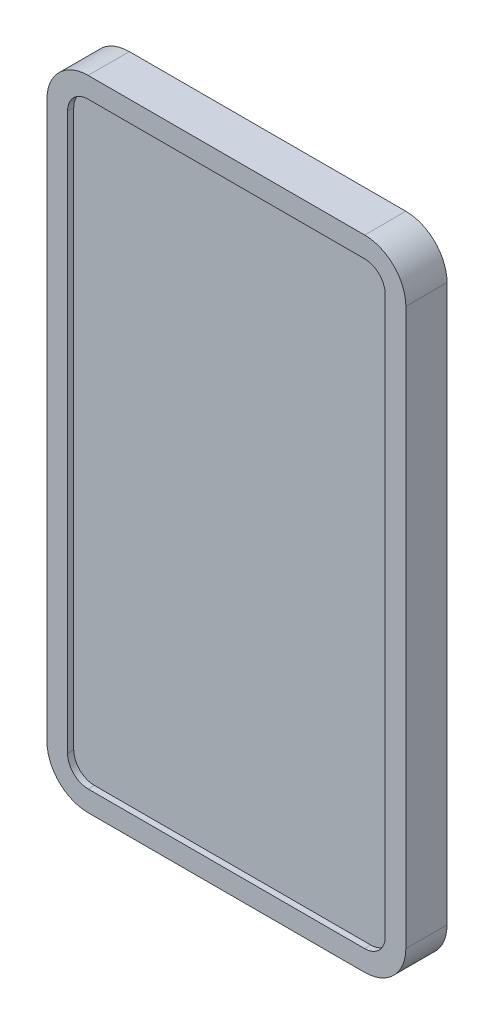
from build123d import *

# Parameters (mm, degrees)
BOSS_EXTRU_1_DEPTH      = 20
ENL_V_MAT_EXTRU_1_DEPTH = 3


with BuildPart() as part:
    # Esquisse1 → Boss.-Extru.1 (new body)
    with BuildSketch(Plane.XY):
        with BuildLine():
            Line((-67.108208568, 155), (67.108208568, 155))
            ThreePointArc((67.108208568, 155), (81.250344192, 149.142135624), (87.108208568, 135))
            Line((87.108208568, 135), (87.108208568, -135))
            ThreePointArc((87.108208568, -135), (81.250344192, -149.142135624), (67.108208568, -155))
            Line((67.108208568, -155), (-67.108208568, -155))
            ThreePointArc((-67.108208568, -155), (-81.250344192, -149.142135624), (-87.108208568, -135))
            Line((-87.108208568, -135), (-87.108208568, 135))
            ThreePointArc((-87.108208568, 135), (-81.250344192, 149.142135624), (-67.108208568, 155))
        make_face()
    extrude(amount=BOSS_EXTRU_1_DEPTH)

    # Esquisse2 → Enlèv. mat.-Extru.1 (cut)
    with BuildSketch(Plane.XY.offset(20)):
        with BuildLine():
            Line((67.108208568, 145), (-67.108208568, 145))
            ThreePointArc((-67.108208568, 145), (-74.17927638, 142.071067812), (-77.108208568, 135))
            Line((-77.108208568, 135), (-77.108208568, -135))
            ThreePointArc((-77.108208568, -135), (-74.17927638, -142.071067812), (-67.108208568, -145))
            Line((-67.108208568, -145), (67.108208568, -145))
            ThreePointArc((67.108208568, -145), (74.17927638, -142.071067812), (77.108208568, -135))
            Line((77.108208568, -135), (77.108208568, 135))
            ThreePointArc((77.108208568, 135), (74.17927638, 142.071067812), (67.108208568, 145))
        make_face()
    extrude(amount=-ENL_V_MAT_EXTRU_1_DEPTH, mode=Mode.SUBTRACT)


solid = part.part
